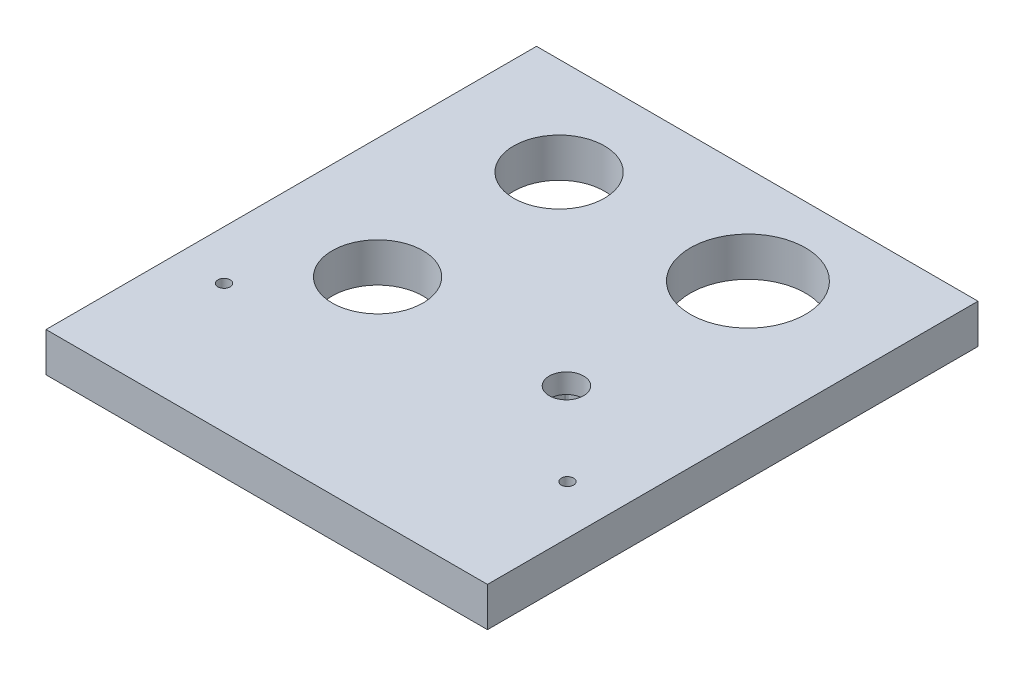
from build123d import *

# Parameters (mm, degrees)
SKETCH_1_W            = 90
SKETCH_1_H            = 100
EXTRUDE_1_DEPTH       = 8
M20X1_51_D            = 18.5
M25X1_51_D            = 23.5
SKETCH_6_W            = 8
SKETCH_6_H            = 8
CUT_EXTRUDE_1_DEPTH   = 4
FILLET_1_R            = 0.3
SKETCH_7_R            = 3.5
CUT_EXTRUDE_2_DEPTH   = 9
HOLE_WIZARD_M31_D     = 2.5
HOLE_WIZARD_M31_DEPTH = 8.5
HOLE_WIZARD_M31_TIP   = 0.751075774


with BuildPart() as part:
    # Эскиз1 → Бобышка-Вытянуть1 (new body)
    with BuildSketch(Plane(origin=(0, 0, 0), x_dir=(1, 0, 0), z_dir=(0, 1, 0))):
        Rectangle(SKETCH_1_W, SKETCH_1_H)
    extrude(amount=EXTRUDE_1_DEPTH)

    # Отверстие обработанное метчиком M20x1,51 (through all)
    with Locations(Plane(origin=(0, 8, 0), x_dir=(1, 0, 0), z_dir=(0, 1, 0))):
        with Locations((-20.5, 30.1), (18, 30.1), (-20.5, -6.9)):
            Hole(M20X1_51_D / 2)

    # Отверстие обработанное метчиком M25x1,51 (through all)
    with Locations(Plane(origin=(0, 8, 0), x_dir=(1, 0, 0), z_dir=(0, 1, 0))):
        with Locations((18, 30.1)):
            Hole(M25X1_51_D / 2)

    # Эскиз6 → Вырез-Вытянуть1 (cut)
    with BuildSketch(Plane.XZ):
        with Locations((18, 6.9)):
            Rectangle(SKETCH_6_W, SKETCH_6_H)
    extrude(amount=-CUT_EXTRUDE_1_DEPTH, mode=Mode.SUBTRACT)

    # Скругление1
    fillet_1_edges = [part.edges().sort_by_distance(p)[0] for p in [
        (14, 2, 2.9),
        (14, 2, 10.9),
        (22, 2, 10.9),
        (22, 2, 2.9),
    ]]
    fillet(fillet_1_edges, radius=FILLET_1_R)

    # Эскиз7 → Вырез-Вытянуть2 (cut)
    with BuildSketch(Plane.XZ.offset(-4)):
        with Locations(Location((18, 6.9, 0), (0, 0, 270))):
            Circle(SKETCH_7_R)
    extrude(amount=-CUT_EXTRUDE_2_DEPTH, mode=Mode.SUBTRACT)

    # Отверстие обработанное метчиком M31
    with Locations(Plane(origin=(0, 8, 0), x_dir=(1, 0, 0), z_dir=(0, 1, 0))):
        with Locations((35, -23.7), (-35, -23.7)):
            Hole(HOLE_WIZARD_M31_D / 2, depth=HOLE_WIZARD_M31_DEPTH)
            with Locations((0, 0, -(HOLE_WIZARD_M31_DEPTH + HOLE_WIZARD_M31_TIP / 2))):  # 118° drill point
                Cone(0, HOLE_WIZARD_M31_D / 2, HOLE_WIZARD_M31_TIP, mode=Mode.SUBTRACT)


solid = part.part
